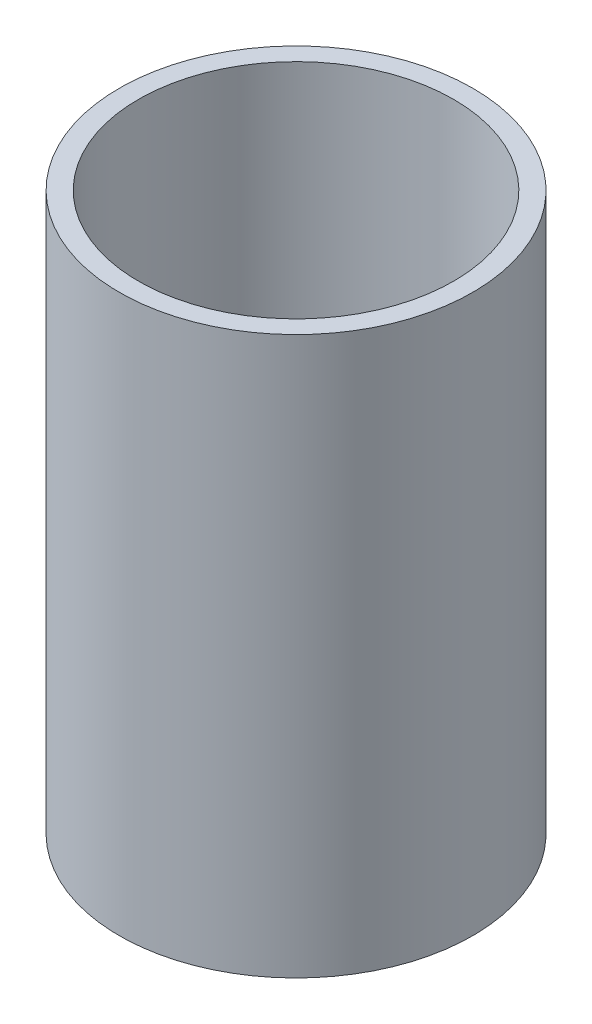
from build123d import *

# Parameters (mm, degrees)
BASES_R    = 4.6
BASES_R_2  = 4.1
BASE_DEPTH = 7.25


with BuildPart() as part:
    # BaseS → BASE (new, symmetric)
    with BuildSketch(Plane(origin=(0, 0, 0), x_dir=(1, 0, 0), z_dir=(0, 1, 0))):
        with Locations(Location((0, 0, 0), (0, 0, 90))):
            Circle(BASES_R)
        with Locations(Location((0, 0, 0), (0, 0, 90))):
            Circle(BASES_R_2, mode=Mode.SUBTRACT)
    extrude(amount=BASE_DEPTH, both=True)


solid = part.part
